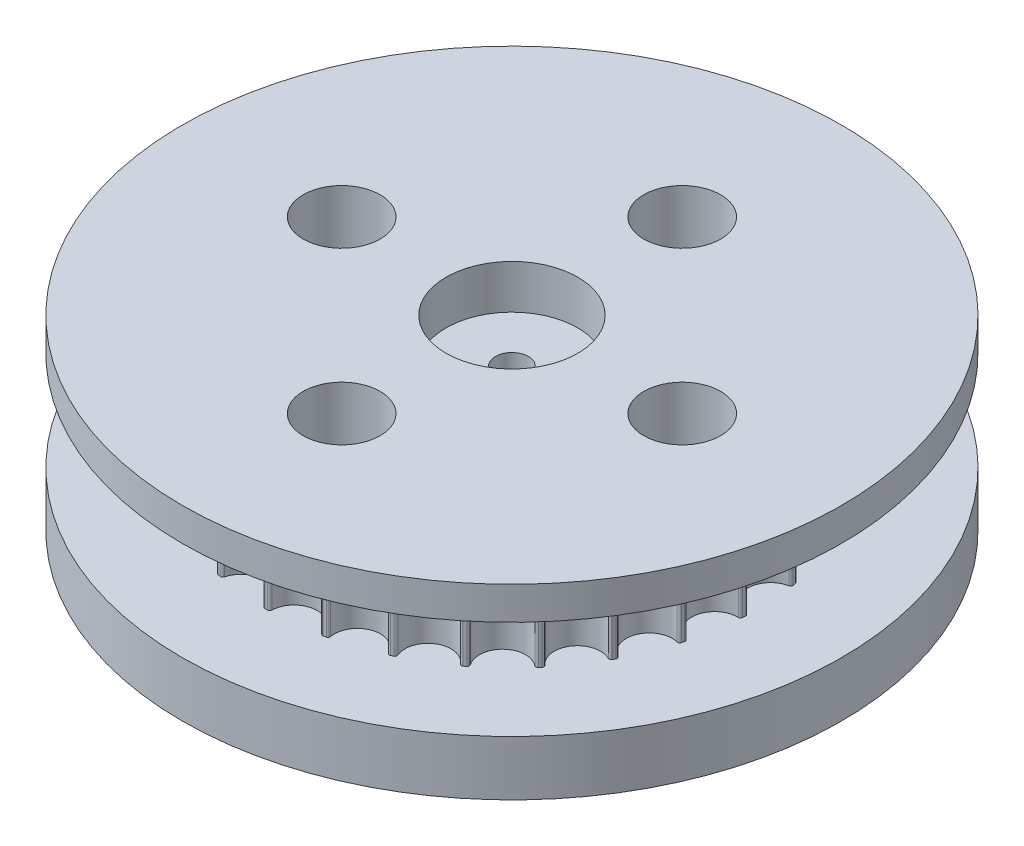
from build123d import *

# Parameters (mm, degrees)
SKETCH1_R           = 30
SKETCH1_R_2         = 1.5
BOSS_EXTRUDE1_DEPTH = 5
SKETCH2_R           = 1.5
BOSS_EXTRUDE2_DEPTH = 9
SKETCH3_R           = 30
SKETCH3_R_2         = 1.5
BOSS_EXTRUDE3_DEPTH = 3
SKETCH4_R           = 6
CUT_EXTRUDE1_DEPTH  = 4
SKETCH5_R           = 1.5
CUT_EXTRUDE2_DEPTH  = 45.09081537
SKETCH6_R           = 3.5
CUT_EXTRUDE3_DEPTH  = 5


with BuildPart() as part:
    # Sketch1 → Boss-Extrude1 (new body)
    with BuildSketch(Plane(origin=(0, 0, 0), x_dir=(1, 0, 0), z_dir=(0, 1, 0))):
        with Locations(Location((0, 0, 0), (0, 0, 270))):
            Circle(SKETCH1_R)
        with Locations(Location((0, 15.5, 0), (0, 0, 270))):
            Circle(SKETCH1_R_2, mode=Mode.SUBTRACT)
        with Locations(Location((15.5, 0, 0), (0, 0, 270))):
            Circle(SKETCH1_R_2, mode=Mode.SUBTRACT)
        with Locations(Location((0, -15.5, 0), (0, 0, 270))):
            Circle(SKETCH1_R_2, mode=Mode.SUBTRACT)
        with Locations(Location((-15.5, 0, 0), (0, 0, 270))):
            Circle(SKETCH1_R_2, mode=Mode.SUBTRACT)
        with Locations(Location((0, 0, 0), (0, 0, 270))):
            Circle(SKETCH1_R_2, mode=Mode.SUBTRACT)
    extrude(amount=BOSS_EXTRUDE1_DEPTH)

    # Sketch2 → Boss-Extrude2 (add)
    with BuildSketch(Plane(origin=(0, 5, 0), x_dir=(1, 0, 0), z_dir=(0, 1, 0))):
        with BuildLine():
            Line((2.298551641, 22.254277442), (2.539199037, 22.228105461))
            ThreePointArc((2.539199037, 22.228105461), (2.670825131, 22.156613046), (2.715887922, 22.013763689))
            ThreePointArc((2.715887922, 22.013763689), (4.358024031, 19.798702775), (6.778466337, 21.119522558))
            ThreePointArc((6.778466337, 21.119522558), (6.879345106, 21.230247749), (7.028824599, 21.239864144))
            Line((7.028824599, 21.239864144), (7.258219591, 21.162571972))
            ThreePointArc((7.258219591, 21.162571972), (7.371399584, 21.064455292), (7.384700443, 20.915258505))
            ThreePointArc((7.384700443, 20.915258505), (8.512271702, 18.398973762), (11.160062622, 19.168589965))
            ThreePointArc((11.160062622, 19.168589965), (11.282385545, 19.255040508), (11.430437531, 19.232298406))
            Line((11.430437531, 19.232298406), (11.637853863, 19.107500139))
            ThreePointArc((11.637853863, 19.107500139), (11.727295585, 18.987347019), (11.708212578, 18.838779079))
            ThreePointArc((11.708212578, 18.838779079), (12.268495009, 16.138929185), (15.019826783, 16.321355409))
            ThreePointArc((15.019826783, 16.321355409), (15.157874175, 16.379488974), (15.297575908, 16.325451769))
            Line((15.297575908, 16.325451769), (15.473315023, 16.158982836))
            ThreePointArc((15.473315023, 16.158982836), (15.534836278, 16.022411503), (15.484261706, 15.881419281))
            ThreePointArc((15.484261706, 15.881419281), (15.451057125, 13.124246216), (18.177280536, 12.710952414))
            ThreePointArc((18.177280536, 12.710952414), (18.324597455, 12.73805074), (18.449416638, 12.655245151))
            Line((18.449416638, 12.655245151), (18.585261171, 12.454889455))
            ThreePointArc((18.585261171, 12.454889455), (18.615985293, 12.308285833), (18.536283966, 12.181461969))
            ThreePointArc((18.536283966, 12.181461969), (17.911144982, 9.495888081), (20.484784855, 8.506199412))
            ThreePointArc((20.484784855, 8.506199412), (20.634482925, 8.500995411), (20.738583151, 8.393293336))
            Line((20.738583151, 8.393293336), (20.828181161, 8.168419286))
            ThreePointArc((20.828181161, 8.168419286), (20.826671525, 8.018638396), (20.72157019, 7.911913033))
            ThreePointArc((20.72157019, 7.911913033), (19.533727607, 5.423512773), (21.834443401, 3.903705978))
            ThreePointArc((21.834443401, 3.903705978), (21.979522907, 3.866442984), (22.058036564, 3.738880453))
            Line((22.058036564, 3.738880453), (22.09719855, 3.500002909))
            ThreePointArc((22.09719855, 3.500002909), (22.063525745, 3.354048341), (21.937938822, 3.272411838))
            ThreePointArc((21.937938822, 3.272411838), (20.242934839, 1.097540036), (22.16314764, -0.881320408))
            ThreePointArc((22.16314764, -0.881320408), (22.296824826, -0.948900019), (22.346080704, -1.090358325))
            Line((22.346080704, -1.090358325), (22.332975494, -1.332069714))
            ThreePointArc((22.332975494, -1.332069714), (22.268714022, -1.467373288), (22.128513816, -1.520103698))
            ThreePointArc((22.128513816, -1.520103698), (20.005604936, -3.279752454), (21.455527729, -5.625137231))
            ThreePointArc((21.455527729, -5.625137231), (21.571551997, -5.719873512), (21.589246946, -5.868613159))
            Line((21.589246946, -5.868613159), (21.524487324, -6.101856237))
            ThreePointArc((21.524487324, -6.101856237), (21.432641981, -6.220182172), (21.284384099, -6.241540875))
            ThreePointArc((21.284384099, -6.241540875), (18.832835181, -7.503687364), (19.744671187, -10.105928889))
            ThreePointArc((19.744671187, -10.105928889), (19.837617372, -10.223392077), (19.822923996, -10.372458165))
            Line((19.822923996, -10.372458165), (19.709538051, -10.586326745))
            ThreePointArc((19.709538051, -10.586326745), (19.594403423, -10.682142251), (19.445020237, -10.671130537))
            ThreePointArc((19.445020237, -10.671130537), (16.779462985, -11.376758193), (17.110575765, -14.114178544))
            ThreePointArc((17.110575765, -14.114178544), (17.176097807, -14.24887619), (17.129703151, -14.391298554))
            Line((17.129703151, -14.391298554), (16.972992683, -14.575792379))
            ThreePointArc((16.972992683, -14.575792379), (16.839952337, -14.644617231), (16.696428841, -14.601749996))
            ThreePointArc((16.696428841, -14.601749996), (13.941501748, -14.717864453), (13.676408837, -17.462464898))
            ThreePointArc((13.676408837, -17.462464898), (13.711442998, -17.60809869), (13.635516425, -17.737217819))
            Line((13.635516425, -17.737217819), (13.442809042, -17.883710162))
            ThreePointArc((13.442809042, -17.883710162), (13.298083797, -17.922326185), (13.167130989, -17.849607853))
            ThreePointArc((13.167130989, -17.849607853), (10.451651384, -17.370779728), (9.602748232, -19.994225801))
            ThreePointArc((9.602748232, -19.994225801), (9.605656353, -20.143986065), (9.503748106, -20.253764491))
            Line((9.503748106, -20.253764491), (9.284054591, -20.355405534))
            ThreePointArc((9.284054591, -20.355405534), (9.134411638, -20.362007086), (9.022152725, -20.262837886))
            ThreePointArc((9.022152725, -20.262837886), (6.473093418, -19.21145665), (5.080073793, -21.591078927))
            ThreePointArc((5.080073793, -21.591078927), (5.050719894, -21.73796304), (4.927595088, -21.823267646))
            Line((4.927595088, -21.823267646), (4.691188066, -21.875304767))
            ThreePointArc((4.691188066, -21.875304767), (4.543624543, -21.849583167), (4.455308628, -21.728600139))
            ThreePointArc((4.455308628, -21.728600139), (2.191860797, -20.153827211), (0.319860749, -22.1783572))
            ThreePointArc((0.319860749, -22.1783572), (0.259617386, -22.315497023), (0.1210332, -22.372339061))
            Line((0.1210332, -22.372339061), (-0.1210332, -22.372339061))
            ThreePointArc((-0.1210332, -22.372339061), (-0.259617386, -22.315497023), (-0.319860749, -22.1783572))
            ThreePointArc((-0.319860749, -22.1783572), (-2.191860797, -20.153827211), (-4.455308628, -21.728600139))
            ThreePointArc((-4.455308628, -21.728600139), (-4.543624543, -21.849583167), (-4.691188066, -21.875304767))
            Line((-4.691188066, -21.875304767), (-4.927595088, -21.823267646))
            ThreePointArc((-4.927595088, -21.823267646), (-5.050719894, -21.73796304), (-5.080073793, -21.591078927))
            ThreePointArc((-5.080073793, -21.591078927), (-6.473093418, -19.21145665), (-9.022152725, -20.262837886))
            ThreePointArc((-9.022152725, -20.262837886), (-9.134411638, -20.362007086), (-9.284054591, -20.355405534))
            Line((-9.284054591, -20.355405534), (-9.503748106, -20.253764491))
            ThreePointArc((-9.503748106, -20.253764491), (-9.605656353, -20.143986065), (-9.602748232, -19.994225801))
            ThreePointArc((-9.602748232, -19.994225801), (-10.451651384, -17.370779728), (-13.167130989, -17.849607853))
            ThreePointArc((-13.167130989, -17.849607853), (-13.298083797, -17.922326185), (-13.442809042, -17.883710162))
            Line((-13.442809042, -17.883710162), (-13.635516425, -17.737217819))
            ThreePointArc((-13.635516425, -17.737217819), (-13.711442998, -17.60809869), (-13.676408837, -17.462464898))
            ThreePointArc((-13.676408837, -17.462464898), (-13.941501748, -14.717864453), (-16.696428841, -14.601749996))
            ThreePointArc((-16.696428841, -14.601749996), (-16.839952337, -14.644617231), (-16.972992683, -14.575792379))
            Line((-16.972992683, -14.575792379), (-17.129703151, -14.391298554))
            ThreePointArc((-17.129703151, -14.391298554), (-17.176097807, -14.24887619), (-17.110575765, -14.114178544))
            ThreePointArc((-17.110575765, -14.114178544), (-16.779462985, -11.376758193), (-19.445020237, -10.671130537))
            ThreePointArc((-19.445020237, -10.671130537), (-19.594403423, -10.682142251), (-19.709538051, -10.586326745))
            Line((-19.709538051, -10.586326745), (-19.822923996, -10.372458165))
            ThreePointArc((-19.822923996, -10.372458165), (-19.837617372, -10.223392077), (-19.744671187, -10.105928889))
            ThreePointArc((-19.744671187, -10.105928889), (-18.832835181, -7.503687364), (-21.284384099, -6.241540875))
            ThreePointArc((-21.284384099, -6.241540875), (-21.432641981, -6.220182172), (-21.524487324, -6.101856237))
            Line((-21.524487324, -6.101856237), (-21.589246946, -5.868613159))
            ThreePointArc((-21.589246946, -5.868613159), (-21.571551997, -5.719873512), (-21.455527729, -5.625137231))
            ThreePointArc((-21.455527729, -5.625137231), (-20.005604936, -3.279752454), (-22.128513816, -1.520103698))
            ThreePointArc((-22.128513816, -1.520103698), (-22.268714022, -1.467373288), (-22.332975494, -1.332069714))
            Line((-22.332975494, -1.332069714), (-22.346080704, -1.090358325))
            ThreePointArc((-22.346080704, -1.090358325), (-22.296824826, -0.948900019), (-22.16314764, -0.881320408))
            ThreePointArc((-22.16314764, -0.881320408), (-20.242934839, 1.097540036), (-21.937938822, 3.272411838))
            ThreePointArc((-21.937938822, 3.272411838), (-22.063525745, 3.354048341), (-22.09719855, 3.500002909))
            Line((-22.09719855, 3.500002909), (-22.058036564, 3.738880453))
            ThreePointArc((-22.058036564, 3.738880453), (-21.979522907, 3.866442984), (-21.834443401, 3.903705978))
            ThreePointArc((-21.834443401, 3.903705978), (-19.533727607, 5.423512773), (-20.72157019, 7.911913033))
            ThreePointArc((-20.72157019, 7.911913033), (-20.826671525, 8.018638396), (-20.828181161, 8.168419286))
            Line((-20.828181161, 8.168419286), (-20.738583151, 8.393293336))
            ThreePointArc((-20.738583151, 8.393293336), (-20.634482925, 8.500995411), (-20.484784855, 8.506199412))
            ThreePointArc((-20.484784855, 8.506199412), (-17.911144982, 9.495888081), (-18.536283966, 12.181461969))
            ThreePointArc((-18.536283966, 12.181461969), (-18.615985293, 12.308285833), (-18.585261171, 12.454889455))
            Line((-18.585261171, 12.454889455), (-18.449416638, 12.655245151))
            ThreePointArc((-18.449416638, 12.655245151), (-18.324597455, 12.73805074), (-18.177280536, 12.710952414))
            ThreePointArc((-18.177280536, 12.710952414), (-15.451057125, 13.124246216), (-15.484261706, 15.881419281))
            ThreePointArc((-15.484261706, 15.881419281), (-15.534836278, 16.022411503), (-15.473315023, 16.158982836))
            Line((-15.473315023, 16.158982836), (-15.297575908, 16.325451769))
            ThreePointArc((-15.297575908, 16.325451769), (-15.157874175, 16.379488974), (-15.019826783, 16.321355409))
            ThreePointArc((-15.019826783, 16.321355409), (-12.268495009, 16.138929185), (-11.708212578, 18.838779079))
            ThreePointArc((-11.708212578, 18.838779079), (-11.727295585, 18.987347019), (-11.637853863, 19.107500139))
            Line((-11.637853863, 19.107500139), (-11.430437531, 19.232298406))
            ThreePointArc((-11.430437531, 19.232298406), (-11.282385545, 19.255040508), (-11.160062622, 19.168589965))
            ThreePointArc((-11.160062622, 19.168589965), (-8.512271702, 18.398973762), (-7.384700443, 20.915258505))
            ThreePointArc((-7.384700443, 20.915258505), (-7.371399584, 21.064455292), (-7.258219591, 21.162571972))
            Line((-7.258219591, 21.162571972), (-7.028824599, 21.239864144))
            ThreePointArc((-7.028824599, 21.239864144), (-6.879345106, 21.230247749), (-6.778466337, 21.119522558))
            ThreePointArc((-6.778466337, 21.119522558), (-4.358024031, 19.798702775), (-2.715887922, 22.013763689))
            ThreePointArc((-2.715887922, 22.013763689), (-2.670825131, 22.156613046), (-2.539199037, 22.228105461))
            Line((-2.539199037, 22.228105461), (-2.298551641, 22.254277442))
            ThreePointArc((-2.298551641, 22.254277442), (-2.154634136, 22.2127522), (-2.079916499, 22.08292975))
            ThreePointArc((-2.079916499, 22.08292975), (0, 20.272666451), (2.079916499, 22.08292975))
            ThreePointArc((2.079916499, 22.08292975), (2.154634136, 22.2127522), (2.298551641, 22.254277442))
        make_face()
        with Locations(Location((0, 15.5, 0), (0, 0, 270))):
            Circle(SKETCH2_R, mode=Mode.SUBTRACT)
        with Locations(Location((15.5, 0, 0), (0, 0, 270))):
            Circle(SKETCH2_R, mode=Mode.SUBTRACT)
        with Locations(Location((0, -15.5, 0), (0, 0, 270))):
            Circle(SKETCH2_R, mode=Mode.SUBTRACT)
        with Locations(Location((-15.5, 0, 0), (0, 0, 270))):
            Circle(SKETCH2_R, mode=Mode.SUBTRACT)
    extrude(amount=BOSS_EXTRUDE2_DEPTH)

    # Sketch3 → Boss-Extrude3 (add)
    with BuildSketch(Plane(origin=(0, 14, 0), x_dir=(1, 0, 0), z_dir=(0, 1, 0))):
        with Locations(Location((0, 0, 0), (0, 0, 270))):
            Circle(SKETCH3_R)
        with Locations(Location((0, 15.5, 0), (0, 0, 270))):
            Circle(SKETCH3_R_2, mode=Mode.SUBTRACT)
        with Locations(Location((15.5, 0, 0), (0, 0, 270))):
            Circle(SKETCH3_R_2, mode=Mode.SUBTRACT)
        with Locations(Location((0, -15.5, 0), (0, 0, 270))):
            Circle(SKETCH3_R_2, mode=Mode.SUBTRACT)
        with Locations(Location((-15.5, 0, 0), (0, 0, 270))):
            Circle(SKETCH3_R_2, mode=Mode.SUBTRACT)
    extrude(amount=BOSS_EXTRUDE3_DEPTH)

    # Sketch4 → Cut-Extrude1 (cut)
    with BuildSketch(Plane(origin=(0, 17, 0), x_dir=(1, 0, 0), z_dir=(0, 1, 0))):
        with Locations(Location((0, 0, 0), (0, 0, 270))):
            Circle(SKETCH4_R)
    extrude(amount=-CUT_EXTRUDE1_DEPTH, mode=Mode.SUBTRACT)

    # Sketch5 → Cut-Extrude2 (cut, through all)
    with BuildSketch(Plane.XZ.offset(-5)):
        with Locations(Location((0, 0, 0), (0, 0, 90))):
            Circle(SKETCH5_R)
    extrude(amount=-CUT_EXTRUDE2_DEPTH, mode=Mode.SUBTRACT)

    # Sketch6 → Cut-Extrude3 (cut)
    with BuildSketch(Plane(origin=(0, 17, 0), x_dir=(1, 0, 0), z_dir=(0, 1, 0))):
        with Locations(Location((15.5, 0, 0), (0, 0, 270))):
            Circle(SKETCH6_R)
        with Locations(Location((0, -15.5, 0), (0, 0, 270))):
            Circle(SKETCH6_R)
        with Locations(Location((-15.5, 0, 0), (0, 0, 270))):
            Circle(SKETCH6_R)
        with Locations(Location((0, 15.5, 0), (0, 0, 270))):
            Circle(SKETCH6_R)
    extrude(amount=-CUT_EXTRUDE3_DEPTH, mode=Mode.SUBTRACT)


solid = part.part
